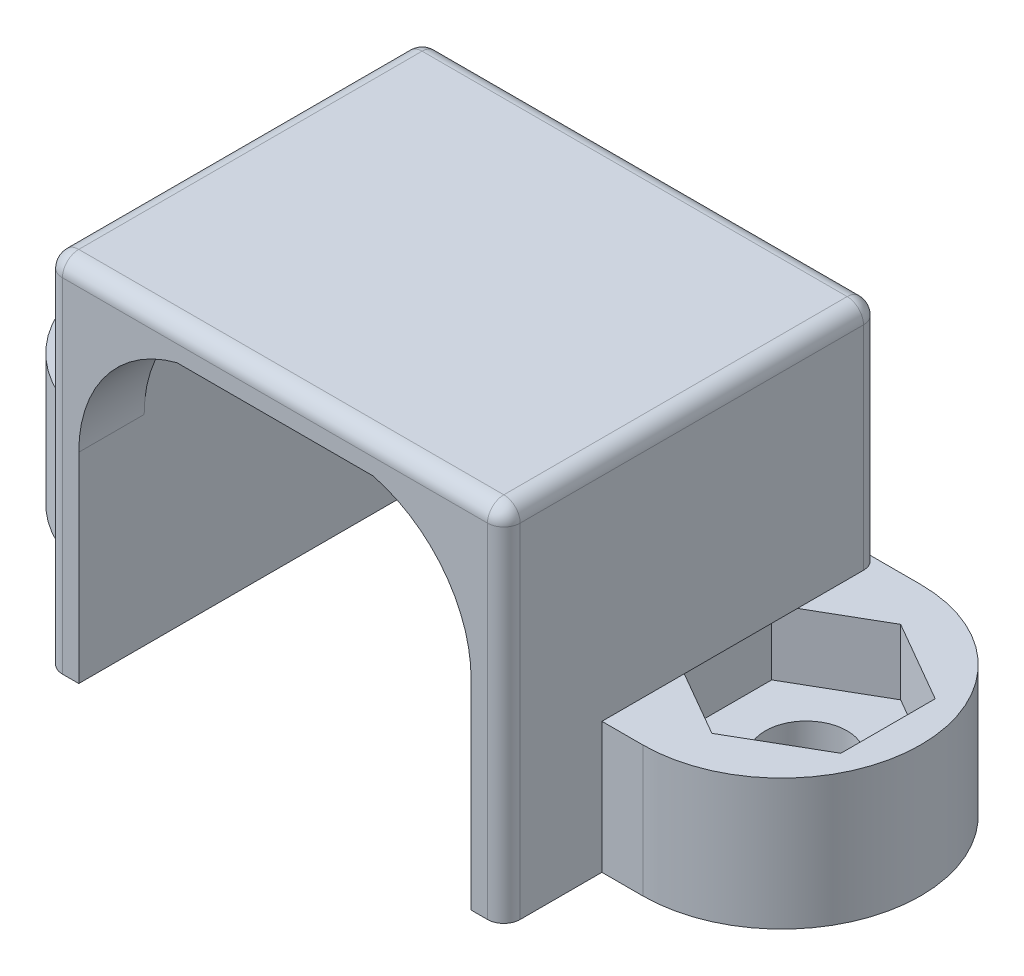
from build123d import *

# Parameters (mm, degrees)
P_IDAT_VYSUNUT_M1_DEPTH  = 11.5
SKICA3_OUTSIDE_W         = 32.928
SKICA3_OUTSIDE_H         = 19.428
ODEBRAT_VYSUNUT_M1_DEPTH = 19.371173071
SKICA4_R                 = 1.25
ODEBRAT_VYSUNUT_M2_DEPTH = 19.371173071
ODEBRAT_VYSUNUT_M3_DEPTH = 2
P_IDAT_VYSUNUT_M2_DEPTH  = 2
ZAOBLIT2_R               = 0.5


with BuildPart() as part:
    # Skica1 → Přidat vysunutím1 (new body)
    with BuildSketch(Plane.XY):
        Polygon((-12.5, 0), (-6, 0), (-6, 10), (6, 10), (6, 0), (12.5, 0), (12.5, 4), (7, 4), (7, 11), (-7, 11), (-7, 4), (-12.5, 4), align=None)
    extrude(amount=P_IDAT_VYSUNUT_M1_DEPTH)

    # Skica3 outside → Odebrat vysunutím1 (cut, through all)
    with BuildSketch(Plane(origin=(0, 4, 0), x_dir=(1, 0, 0), z_dir=(0, 1, 0))):
        with Locations((0, -5.75)):
            Rectangle(SKICA3_OUTSIDE_W, SKICA3_OUTSIDE_H)
        with BuildLine():
            Line((-8.25, 0), (-7, 0))
            Line((-7, 0), (7, 0))
            Line((7, 0), (8.25, 0))
            ThreePointArc((8.25, 0), (12.5, -4.25), (8.25, -8.5))
            Line((8.25, -8.5), (7, -8.5))
            Line((7, -8.5), (7, -11.5))
            Line((7, -11.5), (-7, -11.5))
            Line((-7, -11.5), (-7, -8.5))
            Line((-7, -8.5), (-8.25, -8.5))
            ThreePointArc((-8.25, -8.5), (-12.5, -4.25), (-8.25, 0))
        make_face(mode=Mode.SUBTRACT)
    extrude(amount=-ODEBRAT_VYSUNUT_M1_DEPTH, mode=Mode.SUBTRACT)

    # Skica4 → Odebrat vysunutím2 (cut, through all)
    with BuildSketch(Plane(origin=(0, 4, 0), x_dir=(1, 0, 0), z_dir=(0, 1, 0))):
        with Locations(Location((-9, -4.25, 0), (0, 0, 270))):
            Circle(SKICA4_R)
        with Locations(Location((9, -4.25, 0), (0, 0, 90))):
            Circle(SKICA4_R)
    extrude(amount=-ODEBRAT_VYSUNUT_M2_DEPTH, mode=Mode.SUBTRACT)

    # Skica5 → Odebrat vysunutím3 (cut)
    with BuildSketch(Plane(origin=(0, 4, 0), x_dir=(1, 0, 0), z_dir=(0, 1, 0))):
        Polygon((-6.5, -5.693375673), (-6.5, -2.806624327), (-9, -1.363248654), (-11.5, -2.806624327), (-11.5, -5.693375673), (-9, -7.136751346), align=None)
        Polygon((9, -7.136751346), (6.5, -5.693375673), (6.5, -2.806624327), (9, -1.363248654), (11.5, -2.806624327), (11.5, -5.693375673), align=None)
    extrude(amount=-ODEBRAT_VYSUNUT_M3_DEPTH, mode=Mode.SUBTRACT)

    # Skica6 → Přidat vysunutím2 (add)
    with BuildSketch(Plane.XY.offset(11.5)):
        with BuildLine():
            Line((-6, 10), (-3, 10))
            ThreePointArc((-3, 10), (-5.16227766, 8.576506397), (-6, 6.127016654))
            Line((-6, 6.127016654), (-6, 10))
        make_face()
        with BuildLine():
            Line((6, 6.127016654), (6, 10))
            Line((6, 10), (3, 10))
            ThreePointArc((3, 10), (5.16227766, 8.576506397), (6, 6.127016654))
        make_face()
    extrude(amount=-P_IDAT_VYSUNUT_M2_DEPTH)

    # Zaoblit2
    zaoblit2_edges = [part.edges().sort_by_distance(p)[0] for p in [
        (-7, 7.5, 0),
        (0, 11, 0),
        (7, 7.5, 0),
        (-7, 11, 5.75),
        (7, 11, 5.75),
        (7, 5.5, 11.5),
        (0, 11, 11.5),
        (-7, 5.5, 11.5),
    ]]
    fillet(zaoblit2_edges, radius=ZAOBLIT2_R)


solid = part.part
